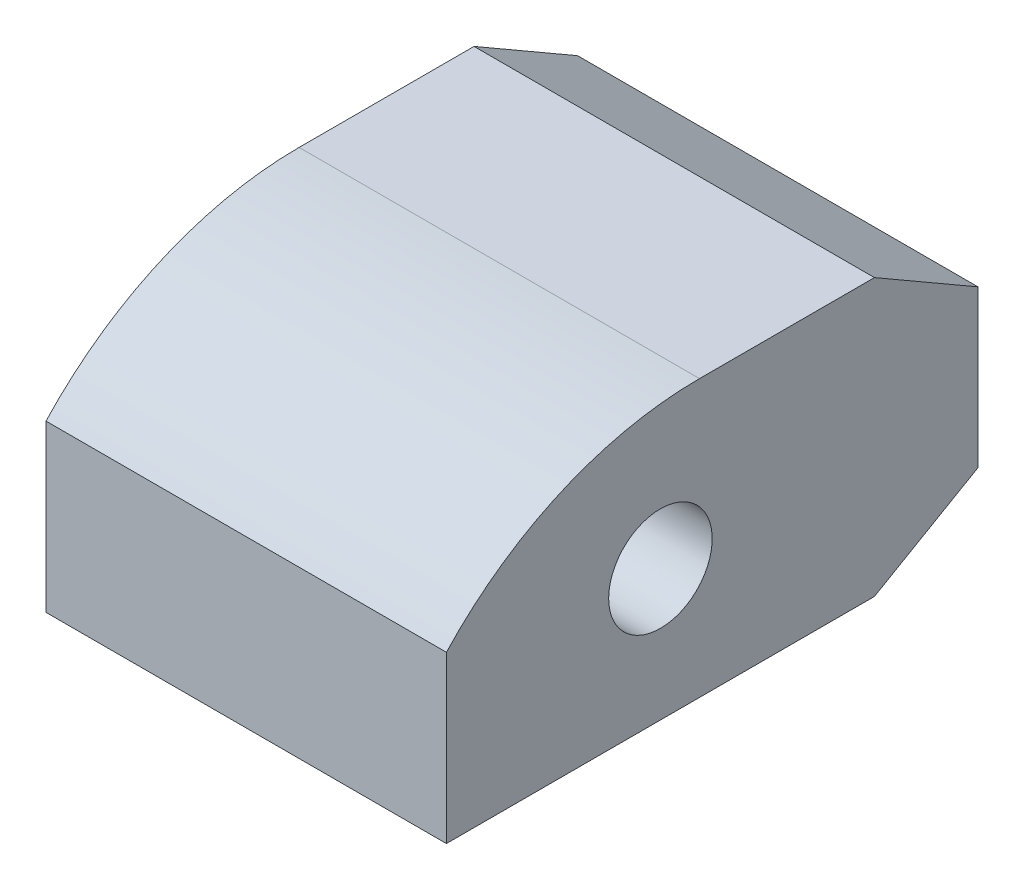
from build123d import *

# Parameters (mm, degrees)
SKETCH1_R           = 7.5
BOSS_EXTRUDE1_DEPTH = 29


with BuildPart() as part:
    # Sketch1 → Boss-Extrude1 (new, symmetric)
    with BuildSketch(Plane(origin=(0, 0, 0), x_dir=(0, 0, -1), z_dir=(1, 0, 0))):
        with BuildLine():
            Line((-31, 5), (-31, -19))
            Line((-31, -19), (31, -19))
            Line((31, -19), (46, -10.339745962))
            Line((46, -10.339745962), (46, 12.339745962))
            Line((46, 12.339745962), (31, 21))
            Line((31, 21), (5.66060556, 21))
            ThreePointArc((5.66060556, 21), (-14.33939444, 16.82575695), (-31, 5))
        make_face()
        with Locations(Location((0, 0, 0), (0, 0, 180))):
            Circle(SKETCH1_R, mode=Mode.SUBTRACT)
    extrude(amount=BOSS_EXTRUDE1_DEPTH, both=True)


solid = part.part
